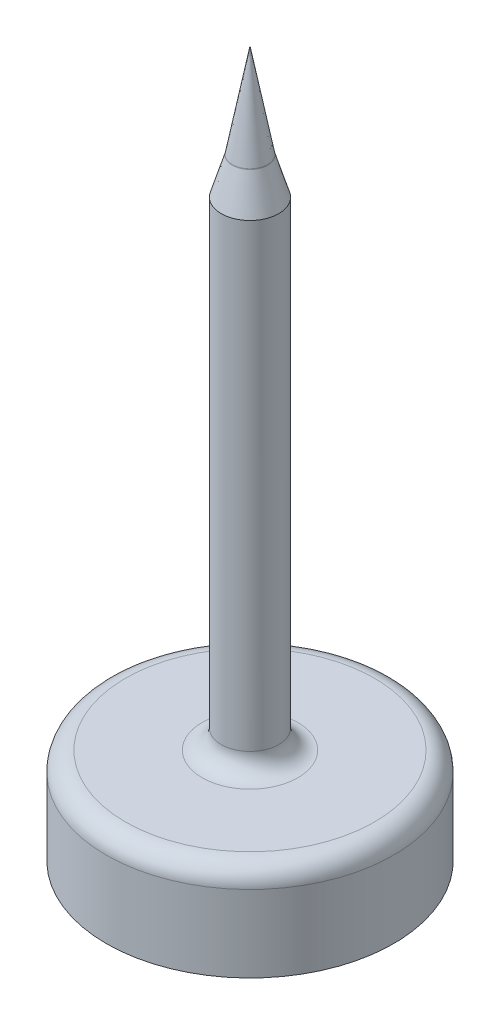
from build123d import *

# Parameters (mm, degrees)
CONG_1_R = 2
CONG_2_R = 2
CONG_3_R = 0.5


with BuildPart() as part:
    # Esquisse1 → Révolution1 (revolve)
    with BuildSketch(Plane(origin=(0, 0, 0), x_dir=(0, 0, -1), z_dir=(1, 0, 0))):
        Polygon((0, 0), (15, 0), (15, 10), (3, 10), (3, 60), (1.846825454, 63.830168203), (0, 73.658150486), align=None)
    revolve(axis=Axis((0, 0, 0), (0, 1, 0)))

    # Congé1
    cong_1_edges = [part.edges().sort_by_distance(p)[0] for p in [
        (0, 10, 15),
    ]]
    fillet(cong_1_edges, radius=CONG_1_R)

    # Congé2
    cong_2_edges = [part.edges().sort_by_distance(p)[0] for p in [
        (0, 10, 3),
    ]]
    fillet(cong_2_edges, radius=CONG_2_R)

    # Congé3
    cong_3_edges = [part.edges().sort_by_distance(p)[0] for p in [
        (0, 63.830168203, 1.846825454),
    ]]
    fillet(cong_3_edges, radius=CONG_3_R)


solid = part.part
